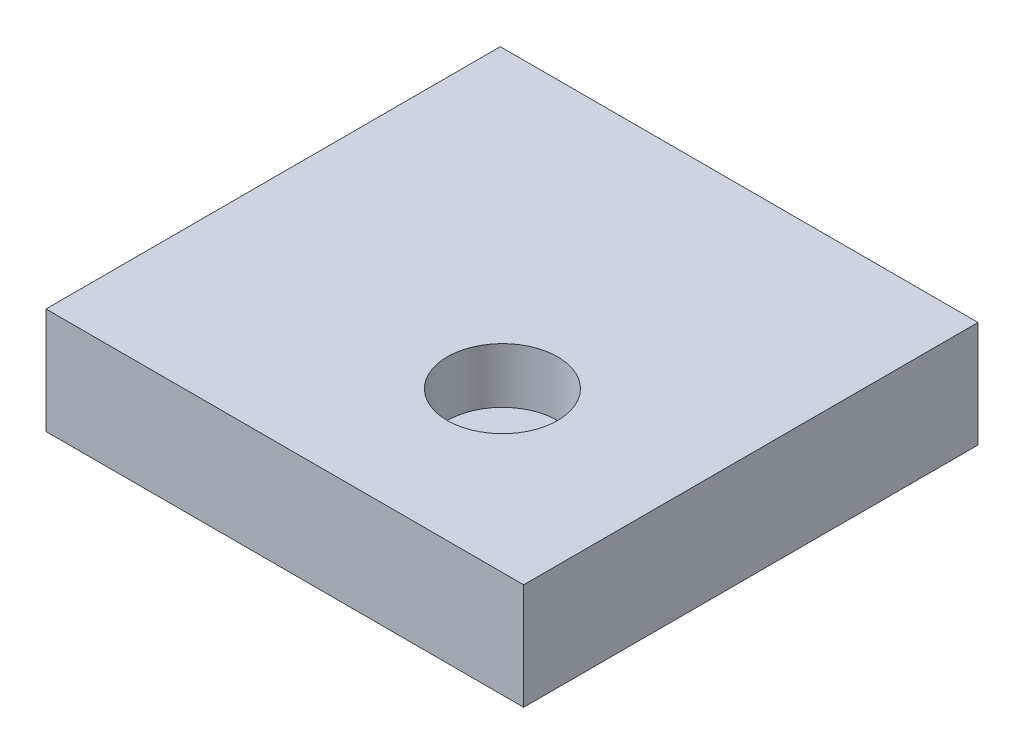
from build123d import *

# Parameters (mm, degrees)
SKETCH_1_W          = 20
SKETCH_1_H          = 21.4
EXTRUDE_1_DEPTH     = 5
SKETCH_4_R          = 0.85
CUT_EXTRUDE_1_DEPTH = 4
SKETCH_5_R          = 0.85
CUT_EXTRUDE_2_DEPTH = 4
SKETCH_6_W          = 21.4
SKETCH_6_H          = 5
EXTRUDE_2_DEPTH     = 2.5
SKETCH_7_R          = 2.6
CUT_EXTRUDE_3_DEPTH = 2.6


with BuildPart() as part:
    # 草图1 → 凸台-拉伸1 (new body)
    with BuildSketch(Plane(origin=(0, 0, 0), x_dir=(1, 0, 0), z_dir=(0, 1, 0))):
        with Locations((-10, -10.7)):
            Rectangle(SKETCH_1_W, SKETCH_1_H)
    extrude(amount=EXTRUDE_1_DEPTH)

    # 草图4 → 切除-拉伸1 (cut)
    with BuildSketch(Plane.ZY.offset(20)):
        with Locations((16.4, 2.5)):
            Circle(SKETCH_4_R)
        with Locations((5, 2.5)):
            Circle(SKETCH_4_R)
    extrude(amount=-CUT_EXTRUDE_1_DEPTH, mode=Mode.SUBTRACT)

    # 草图5 → 切除-拉伸2 (cut)
    with BuildSketch(Plane(origin=(0, 0, 0), x_dir=(-1, 0, 0), z_dir=(0, 0, -1))):
        with Locations((15, 2.5)):
            Circle(SKETCH_5_R)
        with Locations((5, 2.5)):
            Circle(SKETCH_5_R)
    extrude(amount=-CUT_EXTRUDE_2_DEPTH, mode=Mode.SUBTRACT)

    # 草图6 → 凸台-拉伸2 (add)
    with BuildSketch(Plane(origin=(0, 0, 0), x_dir=(0, 0, -1), z_dir=(1, 0, 0))):
        with Locations((-10.7, 2.5)):
            Rectangle(SKETCH_6_W, SKETCH_6_H)
    extrude(amount=EXTRUDE_2_DEPTH)

    # 草图7 → 切除-拉伸3 (cut)
    with BuildSketch(Plane(origin=(0, 5, 0), x_dir=(1, 0, 0), z_dir=(0, 1, 0))):
        with Locations(Location((-6, -13.9, 0), (0, 0, 270))):
            Circle(SKETCH_7_R)
    extrude(amount=-CUT_EXTRUDE_3_DEPTH, mode=Mode.SUBTRACT)


solid = part.part
